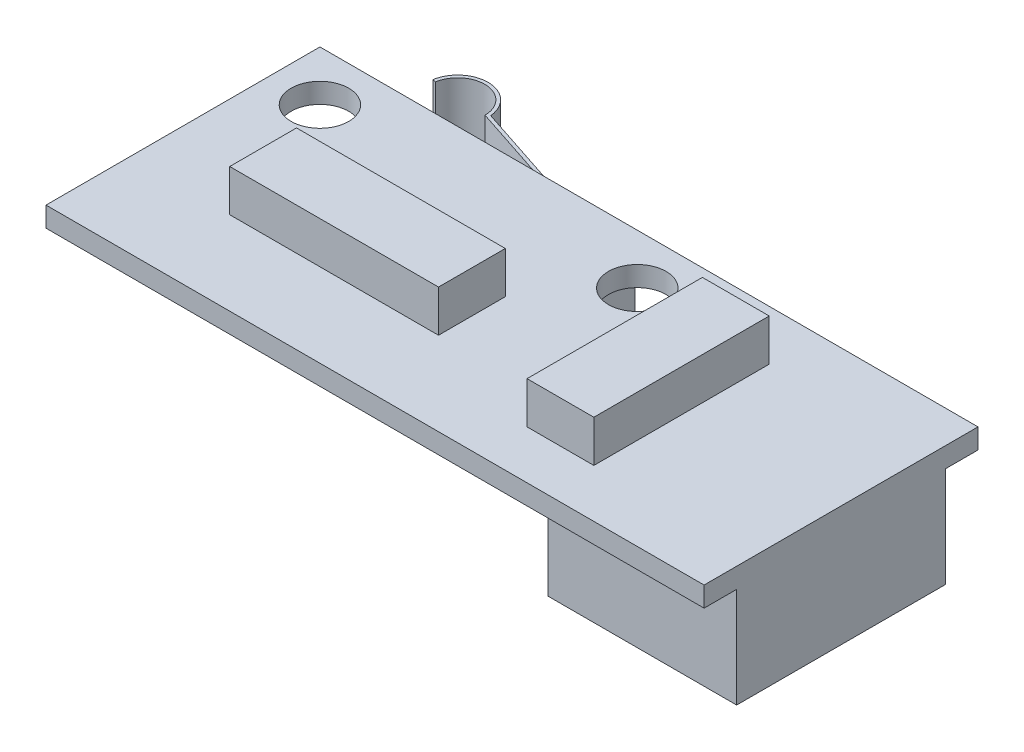
from build123d import *

# Parameters (mm, degrees)
SKETCH1_W           = 39.4
SKETCH1_H           = 16.4
SKETCH1_R           = 1.725
BOSS_EXTRUDE1_DEPTH = 1.2
SKETCH2_W           = 12.5
SKETCH2_H           = 4
SKETCH2_W_2         = 4
SKETCH2_H_2         = 10.5
BOSS_EXTRUDE2_DEPTH = 2.5
SKETCH3_W           = 11.3
SKETCH3_H           = 12.5
SKETCH3_W_2         = 12.75
SKETCH3_H_2         = 6.6
BOSS_EXTRUDE3_DEPTH = 6
BOSS_EXTRUDE4_DEPTH = 2


with BuildPart() as part:
    # Sketch1 → Boss-Extrude1 (new body)
    with BuildSketch(Plane(origin=(0, 0, 0), x_dir=(1, 0, 0), z_dir=(0, 1, 0))):
        Rectangle(SKETCH1_W, SKETCH1_H)
        with Locations(Location((-16.7, 5.2, 0), (0, 0, 270))):
            Circle(SKETCH1_R, mode=Mode.SUBTRACT)
        with Locations(Location((2.3, 5.2, 0), (0, 0, 270))):
            Circle(SKETCH1_R, mode=Mode.SUBTRACT)
    extrude(amount=BOSS_EXTRUDE1_DEPTH)

    # Sketch2 → Boss-Extrude2 (add)
    with BuildSketch(Plane(origin=(0, 1.2, 0), x_dir=(1, 0, 0), z_dir=(0, 1, 0))):
        with Locations((-7.45, -1.2)):
            Rectangle(SKETCH2_W, SKETCH2_H)
        with Locations((8.2, -0.05)):
            Rectangle(SKETCH2_W_2, SKETCH2_H_2)
    extrude(amount=BOSS_EXTRUDE2_DEPTH)

    # Sketch3 → Boss-Extrude3 (add)
    with BuildSketch(Plane.XZ):
        with Locations((14.05, 0)):
            Rectangle(SKETCH3_W, SKETCH3_H)
        with Locations((-7.2, -4.9)):
            Rectangle(SKETCH3_W_2, SKETCH3_H_2)
    extrude(amount=BOSS_EXTRUDE3_DEPTH)

    # Sketch4 → Boss-Extrude4 (add, symmetric)
    with BuildSketch(Plane(origin=(0, -3, 0), x_dir=(-1, 0, 0), z_dir=(0, -1, 0))):
        with BuildLine():
            Line((1.825, 8.2), (13.224013115, 11.95))
            ThreePointArc((13.224013115, 11.95), (14.96605462, 13.598761551), (16.825, 12.083028945))
            Line((16.825, 12.083028945), (16.627742085, 12.050024171))
            ThreePointArc((16.627742085, 12.050024171), (14.909005352, 13.395228648), (13.416459603, 11.802765704))
            Line((13.416459603, 11.802765704), (2.465, 8.2))
            Line((2.465, 8.2), (1.825, 8.2))
        make_face()
    extrude(amount=BOSS_EXTRUDE4_DEPTH, both=True)


solid = part.part
